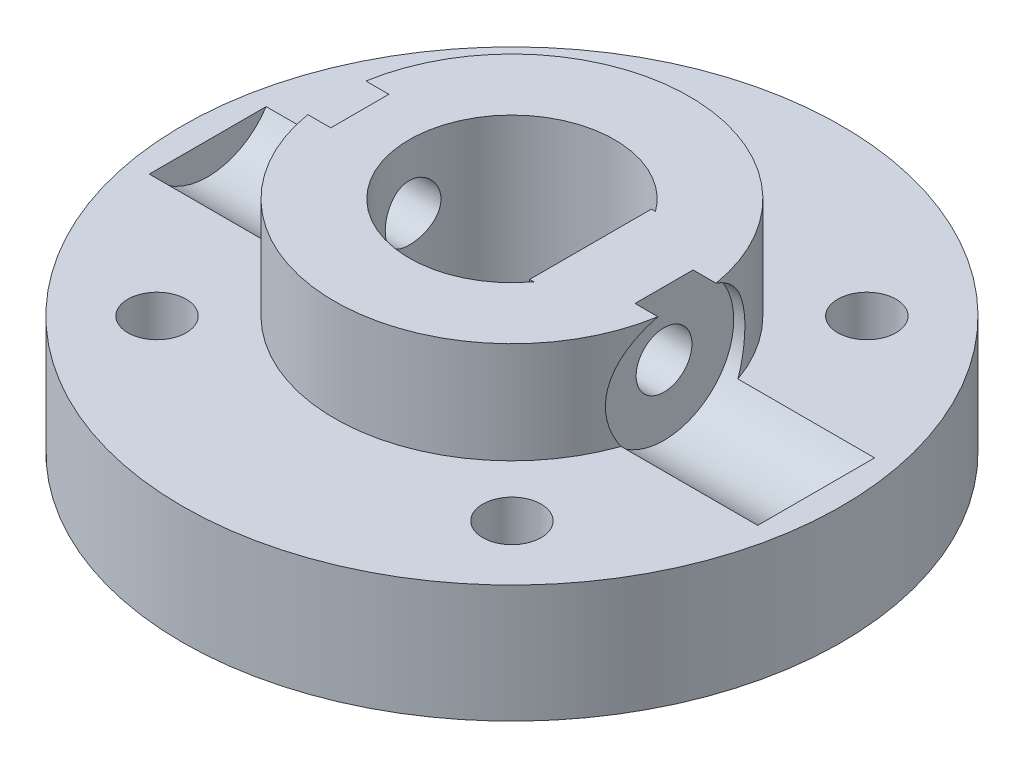
from build123d import *

# Parameters (mm, degrees)
STOCK_HORN_DRIVE_FLANGE_START              = 41
STOCK_HORN_DRIVE_FLANGE_PROFILE_R          = 13
STOCK_HORN_DRIVE_FLANGE_PROFILE_R_2        = 4.05
STOCK_HORN_DRIVE_FLANGE_DEPTH              = 3
D_COUPLING_RING_START                      = 44
D_COUPLING_RING_PROFILE_R                  = 7
D_COUPLING_RING_PROFILE_R_2                = 4.05
D_COUPLING_RING_DEPTH                      = 4
D_KEY_LAND_START                           = 44
D_KEY_LAND_PROFILE_W                       = 2.9
D_KEY_LAND_PROFILE_H                       = 4.8
D_KEY_LAND_DEPTH                           = 4
CAPTURED_HORN_KEY_BOSS_START               = 39.35
CAPTURED_HORN_KEY_BOSS_PROFILE_R           = 13
CAPTURED_HORN_KEY_BOSS_DEPTH               = 1.65
KEY_POCKET_HUB_START                       = 39.35
STOCK_HORN_POCKET_HUB_R                    = 3.55
KEY_POCKET_HUB_DEPTH                       = 1.65
KEY_POCKET_HORIZONTAL_START                = 39.35
STOCK_HORN_POCKET_HORIZONTAL_W             = 16.3
STOCK_HORN_POCKET_HORIZONTAL_H             = 4.2
KEY_POCKET_HORIZONTAL_DEPTH                = 1.65
KEY_POCKET_VERTICAL_START                  = 39.35
STOCK_HORN_POCKET_VERTICAL_W               = 4.2
STOCK_HORN_POCKET_VERTICAL_H               = 16.3
KEY_POCKET_VERTICAL_DEPTH                  = 1.65
KEY_POCKET_ROUNDED_TIPS_START              = 39.35
STOCK_HORN_POCKET_ROUNDED_TIPS_R           = 2.1
KEY_POCKET_ROUNDED_TIPS_DEPTH              = 1.65
UNMODIFIED_HORN_CAPTURE_M2_START           = -50
UNMODIFIED_HORN_CAPTURE_M2_PROFILE_R       = 1.15
UNMODIFIED_HORN_CAPTURE_M2_DEPTH           = 102.400389104
HUB_CLEARANCE_IN_KEY_BOSS_ONLY_START       = 39.35
HORN_CENTER_HUB_CLEARANCE_R                = 4
HUB_CLEARANCE_IN_KEY_BOSS_ONLY_DEPTH       = 1.65
YAW_POSITIVE_RETENTION_CROSSBOLT_START     = -10
YAW_POSITIVE_RETENTION_CROSSBOLT_PROFILE_R = 1.1
YAW_POSITIVE_RETENTION_CROSSBOLT_DEPTH     = 62.400389104
CROSSBOLT_FLAT_SEAT_CUT_12_START           = -12
CROSSBOLT_FLAT_SEAT_12_R                   = 2.75
CROSSBOLT_FLAT_SEAT_CUT_12_DEPTH           = 6
CROSSBOLT_FLAT_SEAT_CUT_6_START            = 6
CROSSBOLT_FLAT_SEAT_6_R                    = 2.75
CROSSBOLT_FLAT_SEAT_CUT_6_DEPTH            = 6


with BuildPart() as part:
    # Stock_horn_drive_flange_profile → Stock_horn_drive_flange (new body)
    with BuildSketch(Plane(origin=(0, 0, 0), x_dir=(1, 0, 0), z_dir=(0, 1, 0)).offset(STOCK_HORN_DRIVE_FLANGE_START)):
        with Locations(Location((0, 0, 0), (0, 0, 270))):
            Circle(STOCK_HORN_DRIVE_FLANGE_PROFILE_R)
        with Locations(Location((0, 0, 0), (0, 0, 270))):
            Circle(STOCK_HORN_DRIVE_FLANGE_PROFILE_R_2, mode=Mode.SUBTRACT)
    extrude(amount=STOCK_HORN_DRIVE_FLANGE_DEPTH)

    # D_coupling_ring_profile → D_coupling_ring (add)
    with BuildSketch(Plane(origin=(0, 0, 0), x_dir=(1, 0, 0), z_dir=(0, 1, 0)).offset(D_COUPLING_RING_START)):
        with Locations(Location((0, 0, 0), (0, 0, 270))):
            Circle(D_COUPLING_RING_PROFILE_R)
        with Locations(Location((0, 0, 0), (0, 0, 270))):
            Circle(D_COUPLING_RING_PROFILE_R_2, mode=Mode.SUBTRACT)
    extrude(amount=D_COUPLING_RING_DEPTH)

    # D_key_land_profile → D_key_land (add)
    with BuildSketch(Plane(origin=(0, 0, 0), x_dir=(1, 0, 0), z_dir=(0, 1, 0)).offset(D_KEY_LAND_START)):
        with Locations((4.55, 0)):
            Rectangle(D_KEY_LAND_PROFILE_W, D_KEY_LAND_PROFILE_H)
    extrude(amount=D_KEY_LAND_DEPTH)

    # Captured_horn_key_boss_profile → Captured_horn_key_boss (add)
    with BuildSketch(Plane(origin=(0, 0, 0), x_dir=(1, 0, 0), z_dir=(0, 1, 0)).offset(CAPTURED_HORN_KEY_BOSS_START)):
        with Locations(Location((0, 0, 0), (0, 0, 270))):
            Circle(CAPTURED_HORN_KEY_BOSS_PROFILE_R)
    extrude(amount=CAPTURED_HORN_KEY_BOSS_DEPTH)

    # Stock_horn_pocket_Hub → Key_pocket_Hub (cut)
    with BuildSketch(Plane(origin=(0, 0, 0), x_dir=(1, 0, 0), z_dir=(0, 1, 0)).offset(KEY_POCKET_HUB_START)):
        with Locations(Location((0, 0, 0), (0, 0, 270))):
            Circle(STOCK_HORN_POCKET_HUB_R)
    extrude(amount=KEY_POCKET_HUB_DEPTH, mode=Mode.SUBTRACT)

    # Stock_horn_pocket_Horizontal → Key_pocket_Horizontal (cut)
    with BuildSketch(Plane(origin=(0, 0, 0), x_dir=(1, 0, 0), z_dir=(0, 1, 0)).offset(KEY_POCKET_HORIZONTAL_START)):
        Rectangle(STOCK_HORN_POCKET_HORIZONTAL_W, STOCK_HORN_POCKET_HORIZONTAL_H)
    extrude(amount=KEY_POCKET_HORIZONTAL_DEPTH, mode=Mode.SUBTRACT)

    # Stock_horn_pocket_Vertical → Key_pocket_Vertical (cut)
    with BuildSketch(Plane(origin=(0, 0, 0), x_dir=(1, 0, 0), z_dir=(0, 1, 0)).offset(KEY_POCKET_VERTICAL_START)):
        Rectangle(STOCK_HORN_POCKET_VERTICAL_W, STOCK_HORN_POCKET_VERTICAL_H)
    extrude(amount=KEY_POCKET_VERTICAL_DEPTH, mode=Mode.SUBTRACT)

    # Stock_horn_pocket_Rounded_tips → Key_pocket_Rounded_tips (cut)
    with BuildSketch(Plane(origin=(0, 0, 0), x_dir=(1, 0, 0), z_dir=(0, 1, 0)).offset(KEY_POCKET_ROUNDED_TIPS_START)):
        with Locations((8.15, 0)):
            Circle(STOCK_HORN_POCKET_ROUNDED_TIPS_R)
        with Locations((-8.15, 0)):
            Circle(STOCK_HORN_POCKET_ROUNDED_TIPS_R)
        with Locations((0, 8.15)):
            Circle(STOCK_HORN_POCKET_ROUNDED_TIPS_R)
        with Locations((0, -8.15)):
            Circle(STOCK_HORN_POCKET_ROUNDED_TIPS_R)
    extrude(amount=KEY_POCKET_ROUNDED_TIPS_DEPTH, mode=Mode.SUBTRACT)

    # Unmodified_horn_capture_M2_profile → Unmodified_horn_capture_M2 (cut, through all)
    with BuildSketch(Plane(origin=(0, 0, 0), x_dir=(1, 0, 0), z_dir=(0, 1, 0)).offset(UNMODIFIED_HORN_CAPTURE_M2_START)):
        with Locations(Location((7, 7, 0), (0, 0, 270))):
            Circle(UNMODIFIED_HORN_CAPTURE_M2_PROFILE_R)
        with Locations(Location((-7, 7, 0), (0, 0, 270))):
            Circle(UNMODIFIED_HORN_CAPTURE_M2_PROFILE_R)
        with Locations(Location((-7, -7, 0), (0, 0, 270))):
            Circle(UNMODIFIED_HORN_CAPTURE_M2_PROFILE_R)
        with Locations(Location((7, -7, 0), (0, 0, 270))):
            Circle(UNMODIFIED_HORN_CAPTURE_M2_PROFILE_R)
    extrude(amount=UNMODIFIED_HORN_CAPTURE_M2_DEPTH, mode=Mode.SUBTRACT)

    # Horn_center_hub_clearance → Hub_clearance_in_key_boss_only (cut)
    with BuildSketch(Plane(origin=(0, 0, 0), x_dir=(1, 0, 0), z_dir=(0, 1, 0)).offset(HUB_CLEARANCE_IN_KEY_BOSS_ONLY_START)):
        Circle(HORN_CENTER_HUB_CLEARANCE_R)
    extrude(amount=HUB_CLEARANCE_IN_KEY_BOSS_ONLY_DEPTH, mode=Mode.SUBTRACT)

    # Yaw_positive_retention_crossbolt_profile → Yaw_positive_retention_crossbolt (cut, through all)
    with BuildSketch(Plane(origin=(0, 0, 0), x_dir=(0, 0, -1), z_dir=(1, 0, 0)).offset(YAW_POSITIVE_RETENTION_CROSSBOLT_START)):
        with Locations(Location((0, 45.5, 0), (0, 0, 180))):
            Circle(YAW_POSITIVE_RETENTION_CROSSBOLT_PROFILE_R)
    extrude(amount=YAW_POSITIVE_RETENTION_CROSSBOLT_DEPTH, mode=Mode.SUBTRACT)

    # Crossbolt_flat_seat_-12 → Crossbolt_flat_seat_cut_-12 (cut)
    with BuildSketch(Plane(origin=(0, 0, 0), x_dir=(0, 0, -1), z_dir=(1, 0, 0)).offset(CROSSBOLT_FLAT_SEAT_CUT_12_START)):
        with Locations((0, 45.5)):
            Circle(CROSSBOLT_FLAT_SEAT_12_R)
    extrude(amount=CROSSBOLT_FLAT_SEAT_CUT_12_DEPTH, mode=Mode.SUBTRACT)

    # Crossbolt_flat_seat_6 → Crossbolt_flat_seat_cut_6 (cut)
    with BuildSketch(Plane(origin=(0, 0, 0), x_dir=(0, 0, -1), z_dir=(1, 0, 0)).offset(CROSSBOLT_FLAT_SEAT_CUT_6_START)):
        with Locations((0, 45.5)):
            Circle(CROSSBOLT_FLAT_SEAT_6_R)
    extrude(amount=CROSSBOLT_FLAT_SEAT_CUT_6_DEPTH, mode=Mode.SUBTRACT)


solid = part.part
